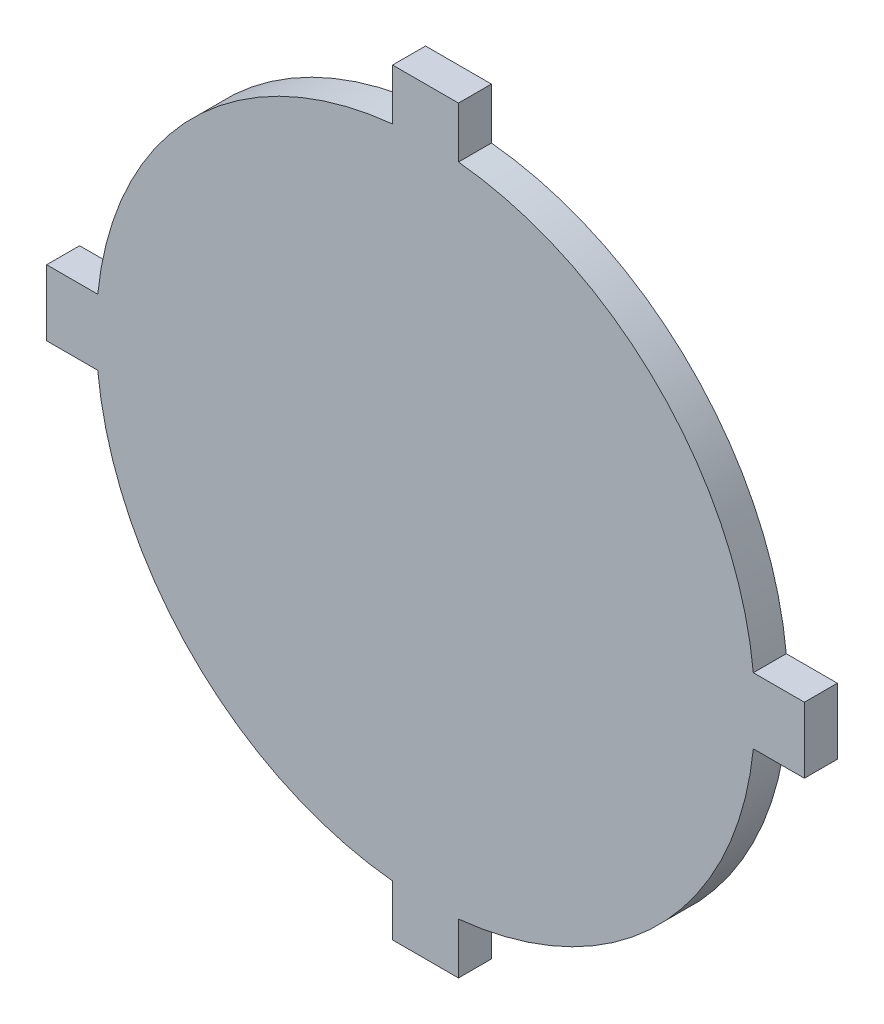
from build123d import *

# Parameters (mm, degrees)
SKETCH_1_R      = 20
EXTRUDE_1_DEPTH = 2
SKETCH_2_W      = 4
SKETCH_2_H      = 4
EXTRUDE_2_DEPTH = 2


with BuildPart() as part:
    # 草图1 → 凸台-拉伸1 (new body)
    with BuildSketch(Plane.XY):
        Circle(SKETCH_1_R)
    extrude(amount=EXTRUDE_1_DEPTH)

    # 草图2 → 凸台-拉伸2 (add)
    with BuildSketch(Plane.XY):
        with Locations((21, 0)):
            Rectangle(SKETCH_2_W, SKETCH_2_H)
        with Locations((0, 21)):
            Rectangle(SKETCH_2_W, SKETCH_2_H)
        with Locations((-21, 0)):
            Rectangle(SKETCH_2_W, SKETCH_2_H)
        with Locations((0, -21)):
            Rectangle(SKETCH_2_W, SKETCH_2_H)
    extrude(amount=EXTRUDE_2_DEPTH)


solid = part.part
